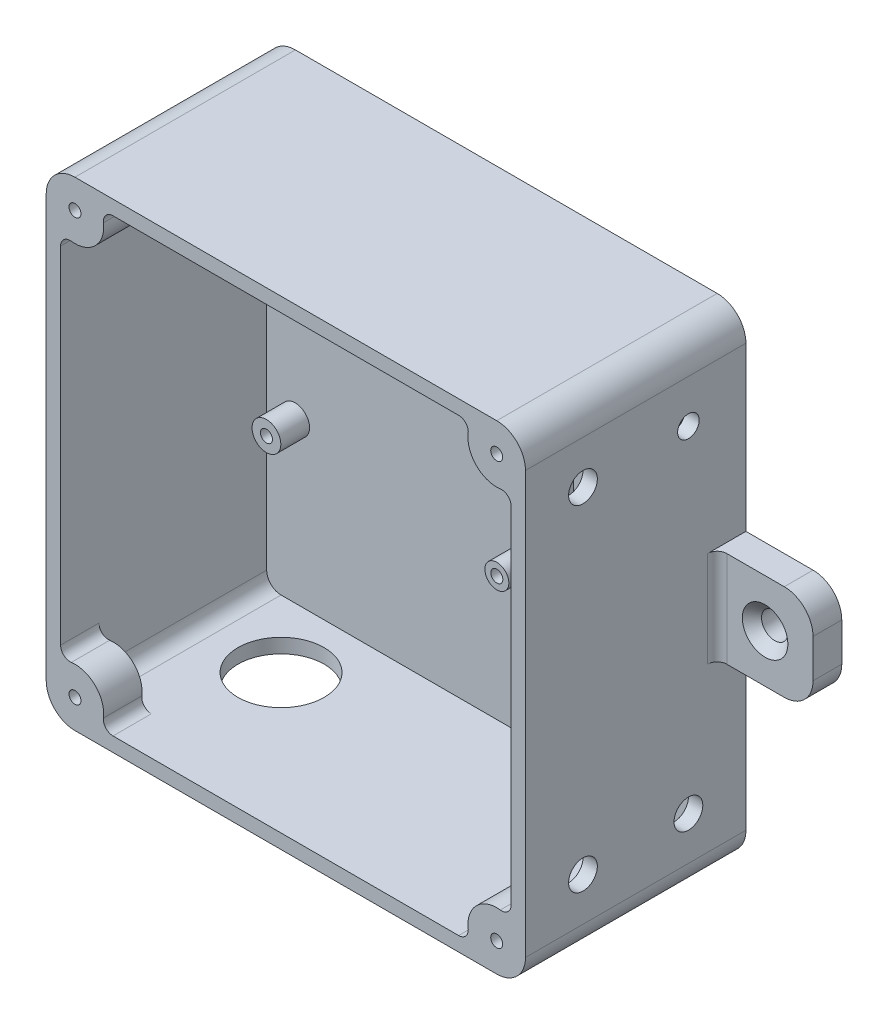
from build123d import *

# Parameters (mm, degrees)
SKETCH1_W           = 100
SKETCH1_H           = 100
BOSS_EXTRUDE1_DEPTH = 46
FILLET1_R           = 6
SHELL1_T            = -3
SKETCH2_R           = 3
SKETCH2_R_2         = 2.25
CUT_EXTRUDE1_DEPTH  = 10
SKETCH3_W           = 26
SKETCH3_H           = 56
SKETCH3_W_2         = 20
SKETCH3_H_2         = 50
BOSS_EXTRUDE2_DEPTH = 5
SKETCH4_R           = 2.5
SKETCH4_R_2         = 1.25
SKETCH4_R_3         = 3
BOSS_EXTRUDE3_DEPTH = 6
SKETCH5_R           = 9
CUT_EXTRUDE2_DEPTH  = 6
SKETCH6_R           = 6
SKETCH6_R_2         = 1.25
BOSS_EXTRUDE4_DEPTH = 8
SKETCH7_R           = 2.75
BOSS_EXTRUDE5_DEPTH = 6
CHAMFER1_SIZE       = 2
FILLET2_R           = 2


with BuildPart() as part:
    # Sketch1 → Boss-Extrude1 (new body)
    with BuildSketch(Plane.XY):
        Rectangle(SKETCH1_W, SKETCH1_H)
    extrude(amount=BOSS_EXTRUDE1_DEPTH)

    # Fillet1
    fillet1_edges = [part.edges().sort_by_distance(p)[0] for p in [
        (50, -50, 23),
        (-50, -50, 23),
        (-50, 50, 23),
        (50, 50, 23),
    ]]
    fillet(fillet1_edges, radius=FILLET1_R)

    # Shell1
    shell1_openings = [part.faces().sort_by_distance(p)[0] for p in [
        (0, 0, 46),
    ]]
    offset(amount=SHELL1_T, openings=shell1_openings, kind=Kind.INTERSECTION)

    # Sketch2 → Cut-Extrude1 (cut)
    with BuildSketch(Plane(origin=(50, 0, 0), x_dir=(0, 0, -1), z_dir=(1, 0, 0))):
        with Locations(Location((-34, 35, 0), (0, 0, 90))):
            Circle(SKETCH2_R)
        with Locations(Location((-34, -35, 0), (0, 0, 90))):
            Circle(SKETCH2_R)
        with Locations(Location((-12, -35, 0), (0, 0, 90))):
            Circle(SKETCH2_R)
        with Locations(Location((-12, 35, 0), (0, 0, 90))):
            Circle(SKETCH2_R_2)
    extrude(amount=-CUT_EXTRUDE1_DEPTH, mode=Mode.SUBTRACT)

    # Sketch3 → Boss-Extrude2 (add)
    with BuildSketch(Plane.XY.offset(3)):
        with Locations((27, 2)):
            Rectangle(SKETCH3_W, SKETCH3_H)
        with Locations((27, 2)):
            Rectangle(SKETCH3_W_2, SKETCH3_H_2, mode=Mode.SUBTRACT)
    extrude(amount=BOSS_EXTRUDE2_DEPTH)

    # Sketch4 → Boss-Extrude3 (add)
    # profile 1 of 4: a face of its own
    with BuildSketch(Plane.XY.offset(3)):
        with Locations((-25.81005519, 37)):
            Circle(SKETCH4_R)
        with Locations((-25.81005519, 37)):
            Circle(SKETCH4_R_2, mode=Mode.SUBTRACT)
    # profile 2 of 4: a face of its own
    with BuildSketch(Plane.XY.offset(3)):
        with Locations((2.12994481, 37)):
            Circle(SKETCH4_R)
        with Locations((2.12994481, 37)):
            Circle(SKETCH4_R_2, mode=Mode.SUBTRACT)
    # profile 3 of 4: a face of its own
    with BuildSketch(Plane.XY.offset(3)):
        with Locations((7.03, -15.07)):
            Circle(SKETCH4_R)
        with Locations((7.03, -15.07)):
            Circle(SKETCH4_R_2, mode=Mode.SUBTRACT)
    # profile 4 of 4: a face of its own
    with BuildSketch(Plane.XY.offset(3)):
        with Locations((-41.05005519, -13.8)):
            Circle(SKETCH4_R_3)
        with Locations((-41.05005519, -13.8)):
            Circle(SKETCH4_R_2, mode=Mode.SUBTRACT)
    extrude(amount=BOSS_EXTRUDE3_DEPTH)

    # Sketch5 → Cut-Extrude2 (cut)
    with BuildSketch(Plane.XZ.offset(50)):
        with Locations(Location((-30, 17, 0), (0, 0, 270))):
            Circle(SKETCH5_R)
    extrude(amount=-CUT_EXTRUDE2_DEPTH, mode=Mode.SUBTRACT)

    # Sketch6 → Boss-Extrude4 (add)
    # profile 1 of 4: a face of its own
    with BuildSketch(Plane.XY.offset(46)):
        with Locations((44, 44)):
            Circle(SKETCH6_R)
        with Locations((44, 44)):
            Circle(SKETCH6_R_2, mode=Mode.SUBTRACT)
    # profile 2 of 4: a face of its own
    with BuildSketch(Plane.XY.offset(46)):
        with Locations((44, -44)):
            Circle(SKETCH6_R)
        with Locations((44, -44)):
            Circle(SKETCH6_R_2, mode=Mode.SUBTRACT)
    # profile 3 of 4: a face of its own
    with BuildSketch(Plane.XY.offset(46)):
        with Locations((-44, -44)):
            Circle(SKETCH6_R)
        with Locations((-44, -44)):
            Circle(SKETCH6_R_2, mode=Mode.SUBTRACT)
    # profile 4 of 4: a face of its own
    with BuildSketch(Plane.XY.offset(46)):
        with Locations((-44, 44)):
            Circle(SKETCH6_R)
        with Locations((-44, 44)):
            Circle(SKETCH6_R_2, mode=Mode.SUBTRACT)
    extrude(amount=-BOSS_EXTRUDE4_DEPTH)

    # Sketch7 → Boss-Extrude5 (add)
    # profile 1 of 2: a face of its own
    with BuildSketch(Plane(origin=(0, 0, 0), x_dir=(-1, 0, 0), z_dir=(0, 0, -1))):
        with BuildLine():
            Line((-50, 10), (-64, 10))
            ThreePointArc((-64, 10), (-68.242640687, 8.242640687), (-70, 4))
            Line((-70, 4), (-70, -4))
            ThreePointArc((-70, -4), (-68.242640687, -8.242640687), (-64, -10))
            Line((-64, -10), (-50, -10))
            Line((-50, -10), (-50, 10))
        make_face()
        with Locations((-60, 0)):
            Circle(SKETCH7_R, mode=Mode.SUBTRACT)
    # profile 2 of 2: a face of its own
    with BuildSketch(Plane(origin=(0, 0, 0), x_dir=(-1, 0, 0), z_dir=(0, 0, -1))):
        with BuildLine():
            Line((70, 4), (70, -4))
            ThreePointArc((70, -4), (68.242640687, -8.242640687), (64, -10))
            Line((64, -10), (50, -10))
            Line((50, -10), (50, 10))
            Line((50, 10), (64, 10))
            ThreePointArc((64, 10), (68.242640687, 8.242640687), (70, 4))
        make_face()
        with Locations(Location((60, 0, 0), (0, 0, 180))):
            Circle(SKETCH7_R, mode=Mode.SUBTRACT)
    extrude(amount=-BOSS_EXTRUDE5_DEPTH)

    # Chamfer1
    chamfer1_edges = [part.edges().sort_by_distance(p)[0] for p in [
        (62.75, 0, 6),
        (-62.75, 0, 6),
    ]]
    chamfer(chamfer1_edges, length=CHAMFER1_SIZE)

    # Fillet2
    fillet2_edges = [part.edges().sort_by_distance(p)[0] for p in [
        (38.803847577, 47, 42),
        (47, 38.803847577, 42),
        (38.803847577, -47, 42),
        (47, -38.803847577, 42),
        (-38.803847577, -47, 42),
        (-47, -38.803847577, 42),
        (-47, 38.803847577, 42),
        (-38.803847577, 47, 42),
        (50, 0, 6),
        (-50, 0, 6),
    ]]
    fillet(fillet2_edges, radius=FILLET2_R)


solid = part.part
